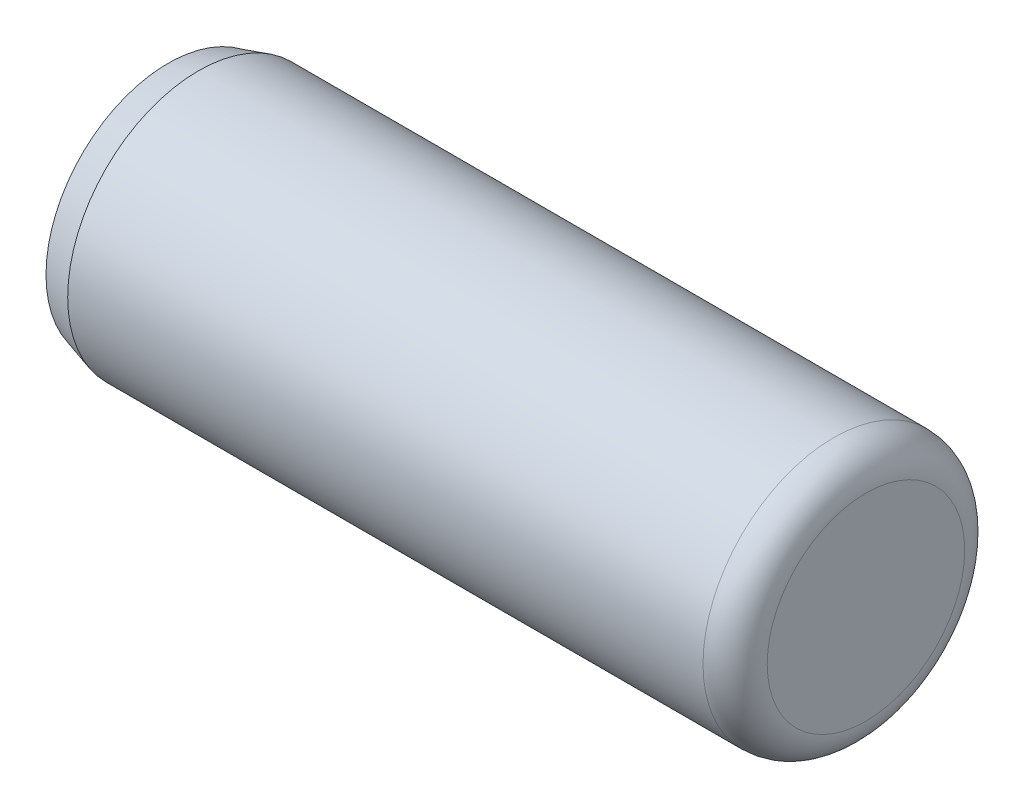
from build123d import *


with BuildPart() as part:
    # Sketch3 → Revolve1 (revolve)
    with BuildSketch(Plane.XY, mode=Mode.PRIVATE) as revolve1_sk:
        with BuildLine():
            Line((6.35, 1.79705), (6.35, 0))
            Line((6.35, 0), (-6.35, 0))
            Line((-6.35, 0), (-6.35, 2.2225))
            Line((-6.35, 2.2225), (-5.796372957, 2.38125))
            Line((-5.796372957, 2.38125), (5.7658, 2.38125))
            ThreePointArc((5.7658, 2.38125), (6.178891782, 2.210141782), (6.35, 1.79705))
        make_face()
    revolve(revolve1_sk.sketch.rotate(Axis((-6.35, 0, 0), (1, 0, 0)), 90), axis=Axis((-6.35, 0, 0), (1, 0, 0)))


solid = part.part
